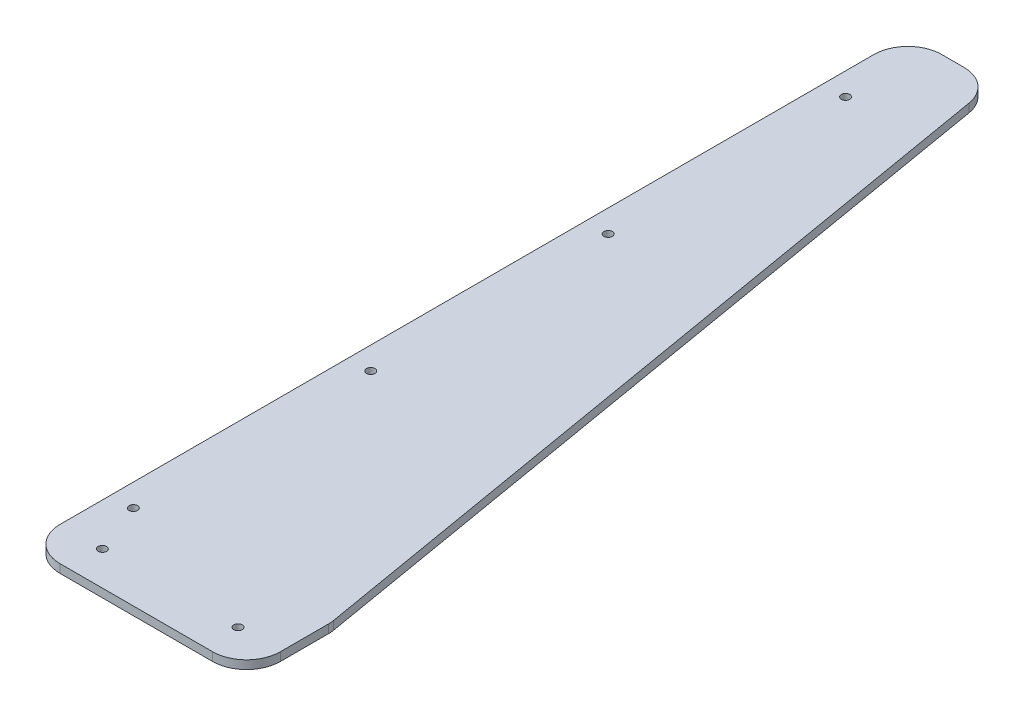
from build123d import *

# Parameters (mm, degrees)
BOSS_EXTRUDE1_DEPTH          = 3.175
FILLET1_R                    = 12.7
F_1_8_0_125_DIAMETER_HOLE1_D = 3.175


with BuildPart() as part:
    # Sketch1 → Boss-Extrude1 (new body)
    with BuildSketch(Plane(origin=(0, 0, 0), x_dir=(1, 0, 0), z_dir=(0, 1, 0))):
        Polygon((31.75, 0), (82.55, 0), (82.55, 31.75), (31.75, 330.2), (0, 330.2), (0, 0), align=None)
    extrude(amount=BOSS_EXTRUDE1_DEPTH)

    # Fillet1
    fillet1_edges = [part.edges().sort_by_distance(p)[0] for p in [
        (0, 1.5875, -330.2),
        (31.75, 1.5875, -330.2),
        (82.55, 1.5875, -31.75),
        (82.55, 1.5875, 0),
        (0, 1.5875, 0),
    ]]
    fillet(fillet1_edges, radius=FILLET1_R)

    # 1/8 (0.125) Diameter Hole1 (through all)
    with Locations(Plane(origin=(0, 0, 0), x_dir=(-1, 0, 0), z_dir=(0, -1, 0))):
        with Locations((-8.4328, 298.45), (-8.4328, 209.55), (-8.4328, 120.65), (-8.4328, 31.75), (-66.675, 12.7), (-15.875, 12.7)):
            Hole(F_1_8_0_125_DIAMETER_HOLE1_D / 2)


solid = part.part
